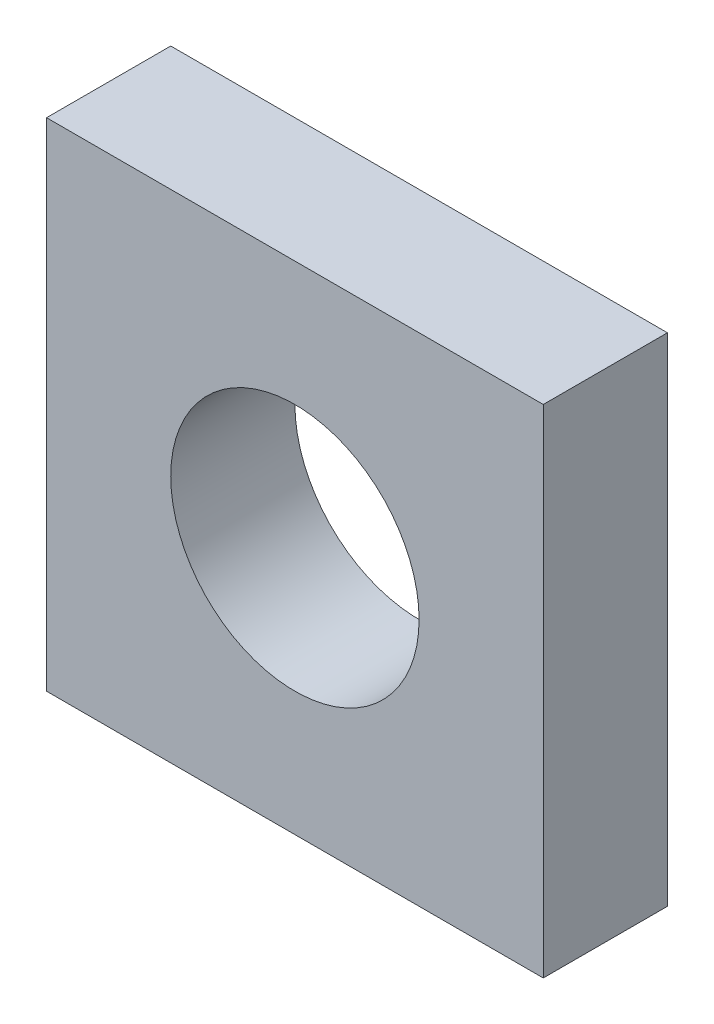
from build123d import *

# Parameters (mm, degrees)
ESQUISSE1_W        = 2
ESQUISSE1_H        = 2
ESQUISSE1_R        = 0.5
BOSS_EXTRU_1_DEPTH = 0.5


with BuildPart() as part:
    # Esquisse1 → Boss.-Extru.1 (new body)
    with BuildSketch(Plane.XY):
        with Locations((0.340195859, -0.297435897)):
            Rectangle(ESQUISSE1_W, ESQUISSE1_H)
        with Locations((0.340195859, -0.297435897)):
            Circle(ESQUISSE1_R, mode=Mode.SUBTRACT)
    extrude(amount=BOSS_EXTRU_1_DEPTH)


solid = part.part
